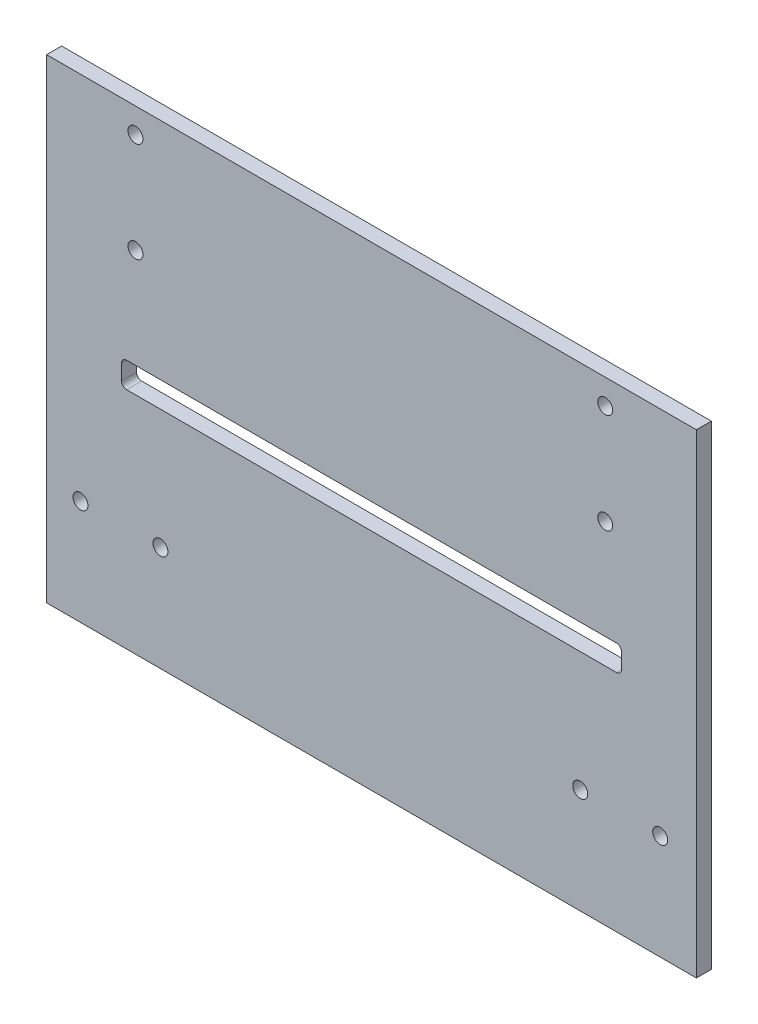
from build123d import *

# Parameters (mm, degrees)
SKETCH_1_W          = 130
SKETCH_1_H          = 95
EXTRUDE_1_DEPTH     = 3
SKETCH_3_R          = 1.5
CUT_EXTRUDE_2_DEPTH = 10
SKETCH_4_R          = 1.5
CUT_EXTRUDE_3_DEPTH = 10
SKETCH_5_W          = 100
SKETCH_5_H          = 5.1
CUT_EXTRUDE_4_DEPTH = 10
FILLET_1_R          = 1
FILLET_2_R          = 1


with BuildPart() as part:
    # 草图1 → 凸台-拉伸1 (new body)
    with BuildSketch(Plane.XY):
        Rectangle(SKETCH_1_W, SKETCH_1_H)
    extrude(amount=EXTRUDE_1_DEPTH)

    # 草图3 → 切除-拉伸2 (cut)
    with BuildSketch(Plane(origin=(0, 0, 0), x_dir=(-1, 0, 0), z_dir=(0, 0, -1))):
        with Locations((-57.767112616, -26.5)):
            Circle(SKETCH_3_R)
        with Locations((-41.767112616, -26.5)):
            Circle(SKETCH_3_R)
        with Locations((42.232887384, -26.5)):
            Circle(SKETCH_3_R)
        with Locations((58.232887384, -26.5)):
            Circle(SKETCH_3_R)
    extrude(amount=-CUT_EXTRUDE_2_DEPTH, mode=Mode.SUBTRACT)

    # 草图4 → 切除-拉伸3 (cut)
    with BuildSketch(Plane(origin=(0, 0, 0), x_dir=(-1, 0, 0), z_dir=(0, 0, -1))):
        with Locations((-46.767112616, 42.5)):
            Circle(SKETCH_4_R)
        with Locations((-46.767112616, 22.5)):
            Circle(SKETCH_4_R)
        with Locations((47.232887384, 42.5)):
            Circle(SKETCH_4_R)
        with Locations((47.232887384, 22.5)):
            Circle(SKETCH_4_R)
    extrude(amount=-CUT_EXTRUDE_3_DEPTH, mode=Mode.SUBTRACT)

    # 草图5 → 切除-拉伸4 (cut)
    with BuildSketch(Plane.XY.offset(3)):
        Rectangle(SKETCH_5_W, SKETCH_5_H)
    extrude(amount=-CUT_EXTRUDE_4_DEPTH, mode=Mode.SUBTRACT)

    # 圆角1
    fillet_1_edges = [part.edges().sort_by_distance(p)[0] for p in [
        (-50, 2.55, 1.5),
    ]]
    fillet(fillet_1_edges, radius=FILLET_1_R)

    # 圆角2
    fillet_2_edges = [part.edges().sort_by_distance(p)[0] for p in [
        (-50, -2.55, 1.5),
        (50, 2.55, 1.5),
        (50, -2.55, 1.5),
    ]]
    fillet(fillet_2_edges, radius=FILLET_2_R)


solid = part.part
